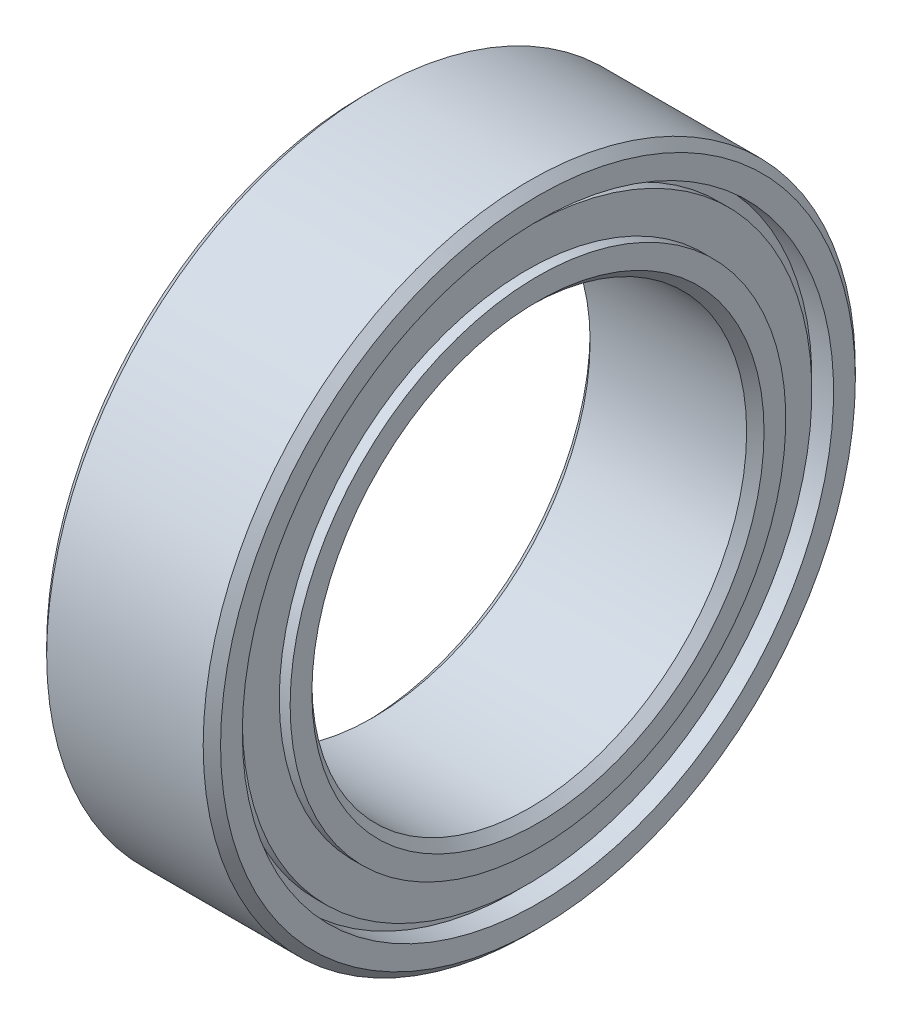
from build123d import *

# Parameters (mm, degrees)
CHAMFER_1_SIZE = 0.2


with BuildPart() as part:
    # 草图1 → 旋转1 (revolve)
    with BuildSketch(Plane.XY, mode=Mode.PRIVATE) as revolve_1_sk:
        Polygon((-2, 5), (2, 5), (2, 5.7), (1.75, 5.7), (1.75, 6.55), (1.5, 6.55), (1.5, 6.8), (2, 6.8), (2, 7.5), (-2, 7.5), (-2, 6.8), (-1.5, 6.8), (-1.5, 6.55), (-1.75, 6.55), (-1.75, 5.7), (-2, 5.7), align=None)
    revolve(revolve_1_sk.sketch.rotate(Axis((-3.90102381, 0, 0), (1, 0, 0)), 90), axis=Axis((-3.90102381, 0, 0), (1, 0, 0)))

    # 倒角1
    chamfer_1_edges = [part.edges().sort_by_distance(p)[0] for p in [
        (-2, 0, -7.5),
        (2, 0, -7.5),
        (2, 0, -5),
        (-2, 0, -5),
    ]]
    chamfer(chamfer_1_edges, length=CHAMFER_1_SIZE)


solid = part.part
